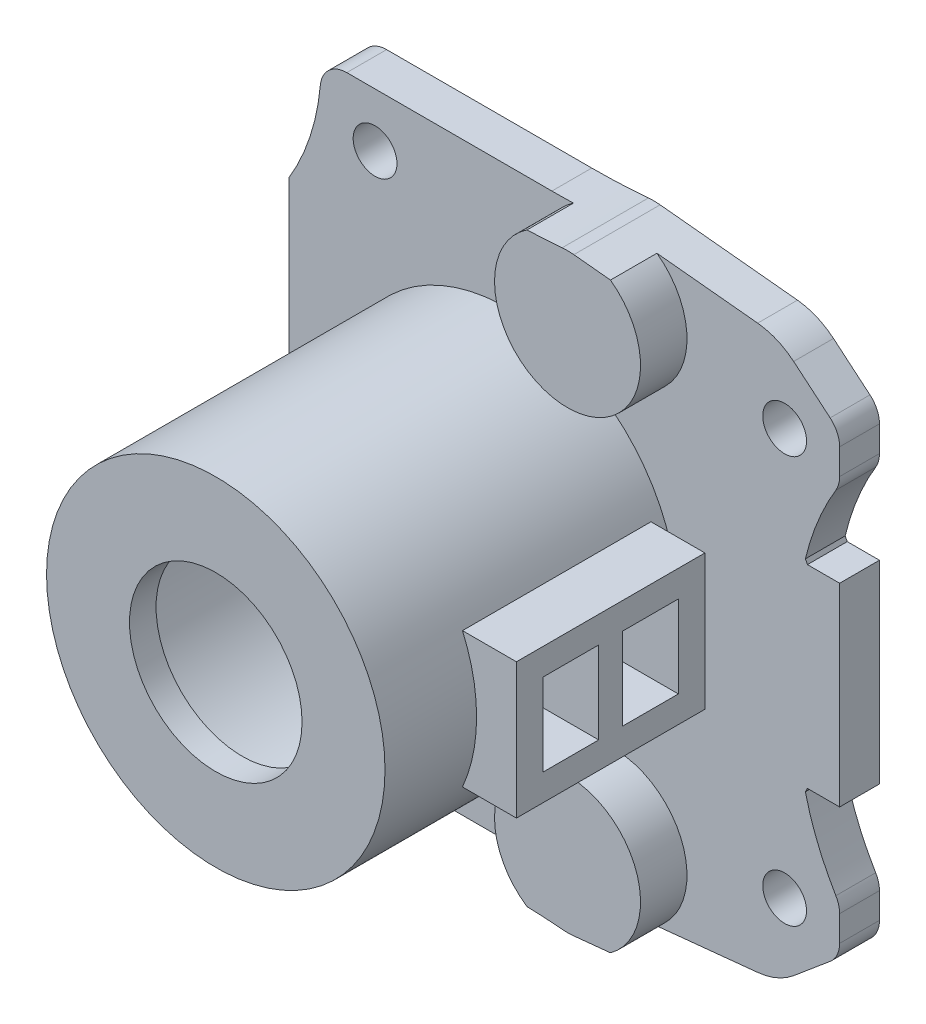
from build123d import *
from build123d.topology import SkipClean

# Parameters (mm, degrees)
SKETCH_1_R               = 2.05
EXTRUDE_1_DEPTH          = 3
EXTRUDE_START            = -3
SKETCH_2_R               = 2.05
SKETCH_2_R_2             = 1.65
SKETCH_2_R_3             = 6
EXTRUDE_2_DEPTH          = 3
SKETCH_3_R               = 4
EXTRUDE_3_DEPTH          = 2
EXTRUDE_4_DEPTH          = 1.5
SKETCH_5_R               = 12.75
SKETCH_5_R_2             = 10.75
EXTRUDE_5_DEPTH          = 20
CUT_EXTRUDE_START        = -3
SKETCH_6_R               = 10.75
CUT_EXTRUDE_1_DEPTH      = 3
SKETCH_8_R               = 12.75
SKETCH_8_R_2             = 6.5
EXTRUDE_6_DEPTH          = 2
CUT_EXTRUDE_2_REACH      = 43.774
CUT_EXTRUDE_2_END_RADIUS = 12.75
SKETCH_9_W               = 4.2
SKETCH_9_H               = 6.2
SKETCH_10_W              = 14.2
SKETCH_10_H              = 10.2
SKETCH_10_W_2            = 4.2
SKETCH_10_H_2            = 6.2
EXTRUDE_9_DEPTH          = 5


with BuildPart() as part:
    # Эскиз1 → Бобышка-Вытянуть1 (new body)
    with BuildSketch(Plane.XY):
        with BuildLine():
            Line((-12.130016239, -22.05), (6.63618183, -22.05))
            ThreePointArc((6.63618183, -22.05), (7.548005274, -22.228445915), (8.47712251, -22.225976525))
            Line((8.47712251, -22.225976525), (18.824472693, -21.181334498))
            ThreePointArc((18.824472693, -21.181334498), (20.266447405, -20.813145093), (21.53617652, -20.036844583))
            Line((21.53617652, -20.036844583), (24.285575219, -17.729825148))
            ThreePointArc((24.285575219, -17.729825148), (24.812615574, -17.042972786), (25, -16.197736262))
            Line((25, -16.197736262), (25, -14.258781673))
            ThreePointArc((25, -14.258781673), (24.927604034, -13.725543744), (24.715657311, -13.230910089))
            ThreePointArc((24.715657311, -13.230910089), (23.352457929, -10.503222461), (22.419778084, -7.6))
            Line((22.419778084, -7.6), (20.113215923, -7.6))
            ThreePointArc((20.113215923, -7.6), (16.619779633, -11.410056927), (12, -13.729166034))
            Line((12, -13.729166034), (12, -17.5))
            ThreePointArc((12, -17.5), (8, -21.5), (4, -17.5))
            Line((4, -17.5), (4, -13.729166034))
            ThreePointArc((4, -13.729166034), (-6.3, 0), (4, 13.729166034))
            Line((4, 13.729166034), (4, 17.5))
            ThreePointArc((4, 17.5), (8, 21.5), (12, 17.5))
            Line((12, 17.5), (12, 13.729166034))
            ThreePointArc((12, 13.729166034), (16.619779633, 11.410056927), (20.113215923, 7.6))
            Line((20.113215923, 7.6), (22.419778084, 7.6))
            ThreePointArc((22.419778084, 7.6), (23.352457929, 10.503222461), (24.715657311, 13.230910089))
            ThreePointArc((24.715657311, 13.230910089), (24.927604034, 13.725543744), (25, 14.258781673))
            Line((25, 14.258781673), (25, 16.197736262))
            ThreePointArc((25, 16.197736262), (24.812615574, 17.042972786), (24.285575219, 17.729825148))
            Line((24.285575219, 17.729825148), (21.53617652, 20.036844583))
            ThreePointArc((21.53617652, 20.036844583), (20.266447405, 20.813145093), (18.824472693, 21.181334498))
            Line((18.824472693, 21.181334498), (8.47712251, 22.225976525))
            ThreePointArc((8.47712251, 22.225976525), (8.035899486, 22.249864338), (7.594365799, 22.232648402))
            ThreePointArc((7.594365799, 22.232648402), (5.461401325, 22.09568297), (3.324532109, 22.05))
            Line((3.324532109, 22.05), (-12.130016239, 22.05))
            ThreePointArc((-12.130016239, 22.05), (-13.477844915, 21.527618984), (-14.121593477, 20.233357861))
            ThreePointArc((-14.121593477, 20.233357861), (-14.900607263, 16.481804182), (-16.5, 13))
            Line((-16.5, 13), (-16.5, -13))
            ThreePointArc((-16.5, -13), (-14.900607263, -16.481804182), (-14.121593477, -20.233357861))
            ThreePointArc((-14.121593477, -20.233357861), (-13.477844915, -21.527618984), (-12.130016239, -22.05))
        make_face()
        with Locations((-10, -18)):
            Circle(SKETCH_1_R, mode=Mode.SUBTRACT)
        with Locations((20.855752194, -15.320888862)):
            Circle(SKETCH_1_R, mode=Mode.SUBTRACT)
        with Locations((20.855752194, 15.320888862)):
            Circle(SKETCH_1_R, mode=Mode.SUBTRACT)
        with Locations((-10, 18)):
            Circle(SKETCH_1_R, mode=Mode.SUBTRACT)
    extrude(amount=EXTRUDE_1_DEPTH)

    # Эскиз2 → Бобышка-Вытянуть2 (add)
    # profile 1 of 5: a face of its own
    with SkipClean():  # the faces are left unmerged after this step: merging them gives an invalid solid
        with BuildSketch(Plane.XY.offset(3).offset(EXTRUDE_START)):
            with Locations((20.855752194, -15.320888862)):
                Circle(SKETCH_2_R)
            with Locations((20.855752194, -15.320888862)):
                Circle(SKETCH_2_R_2, mode=Mode.SUBTRACT)
        # profile 2 of 5: a face of its own
        with BuildSketch(Plane.XY.offset(3).offset(EXTRUDE_START)):
            with Locations((-10, -18)):
                Circle(SKETCH_2_R)
            with Locations((-10, -18)):
                Circle(SKETCH_2_R_2, mode=Mode.SUBTRACT)
        # profile 3 of 5: a face of its own
        with BuildSketch(Plane.XY.offset(3).offset(EXTRUDE_START)):
            with Locations((20.855752194, 15.320888862)):
                Circle(SKETCH_2_R)
            with Locations((20.855752194, 15.320888862)):
                Circle(SKETCH_2_R_2, mode=Mode.SUBTRACT)
        # profile 4 of 5: a face of its own
        with BuildSketch(Plane.XY.offset(3).offset(EXTRUDE_START)):
            with Locations((-10, 18)):
                Circle(SKETCH_2_R)
            with Locations((-10, 18)):
                Circle(SKETCH_2_R_2, mode=Mode.SUBTRACT)
        # profile 5 of 5: a face of its own
        with BuildSketch(Plane.XY.offset(3).offset(EXTRUDE_START)):
            with BuildLine():
                Line((20.113215923, 7.6), (22.419778084, 7.6))
                ThreePointArc((22.419778084, 7.6), (22.497639732, 7.450398794), (22.573949362, 7.3))
                Line((22.573949362, 7.3), (25, 7.3))
                Line((25, 7.3), (25, -7.3))
                Line((25, -7.3), (22.573949362, -7.3))
                ThreePointArc((22.573949362, -7.3), (22.497639732, -7.450398794), (22.419778084, -7.6))
                Line((22.419778084, -7.6), (20.113215923, -7.6))
                ThreePointArc((20.113215923, -7.6), (16.619779633, -11.410056927), (12, -13.729166034))
                Line((12, -13.729166034), (12, -17.5))
                ThreePointArc((12, -17.5), (8, -13.5), (4, -17.5))
                Line((4, -17.5), (4, -13.729166034))
                ThreePointArc((4, -13.729166034), (-6.3, 0), (4, 13.729166034))
                Line((4, 13.729166034), (4, 17.5))
                ThreePointArc((4, 17.5), (8, 13.5), (12, 17.5))
                Line((12, 17.5), (12, 13.729166034))
                ThreePointArc((12, 13.729166034), (16.619779633, 11.410056927), (20.113215923, 7.6))
            make_face()
            Circle(SKETCH_2_R_3, mode=Mode.SUBTRACT)
        extrude(amount=EXTRUDE_2_DEPTH)

    # Эскиз3 → Бобышка-Вытянуть3 (add)
    # profile 1 of 2: a face of its own
    with SkipClean():  # the faces are left unmerged after this step: merging them gives an invalid solid
        with BuildSketch(Plane.XY.offset(3)):
            with BuildLine():
                Line((11.235733835, 21.947474176), (8.47712251, 22.225976525))
                ThreePointArc((8.47712251, 22.225976525), (8.035899486, 22.249864338), (7.594365799, 22.232648402))
                ThreePointArc((7.594365799, 22.232648402), (6.272890386, 22.137003862), (4.949344701, 22.076407133))
                ThreePointArc((4.949344701, 22.076407133), (7.887219492, 12.001156435), (11.235733835, 21.947474176))
            make_face()
            with Locations((8, 17.5)):
                Circle(SKETCH_3_R, mode=Mode.SUBTRACT)
        # profile 2 of 2: a face of its own
        with BuildSketch(Plane.XY.offset(3)):
            with BuildLine():
                Line((11.235733835, -21.947474176), (8.47712251, -22.225976525))
                ThreePointArc((8.47712251, -22.225976525), (8.035899486, -22.249864338), (7.594365799, -22.232648402))
                ThreePointArc((7.594365799, -22.232648402), (6.272890386, -22.137003862), (4.949344701, -22.076407133))
                ThreePointArc((4.949344701, -22.076407133), (7.887219492, -12.001156435), (11.235733835, -21.947474176))
            make_face()
            with Locations(Location((8, -17.5, 0), (0, 0, 180))):
                Circle(SKETCH_3_R, mode=Mode.SUBTRACT)
        extrude(amount=EXTRUDE_3_DEPTH)

    # Эскиз4 → Бобышка-Вытянуть4 (add)
    with SkipClean():  # the faces are left unmerged after this step: merging them gives an invalid solid
        with BuildSketch(Plane.XY.offset(5)):
            with BuildLine():
                Line((8.47712251, -22.225976525), (11.235733835, -21.947474176))
                ThreePointArc((11.235733835, -21.947474176), (7.887219492, -12.001156435), (4.949344701, -22.076407133))
                ThreePointArc((4.949344701, -22.076407133), (6.272890386, -22.137003862), (7.594365799, -22.232648402))
                ThreePointArc((7.594365799, -22.232648402), (8.035899486, -22.249864338), (8.47712251, -22.225976525))
            make_face()
            with BuildLine():
                Line((11.235733835, 21.947474176), (8.47712251, 22.225976525))
                ThreePointArc((8.47712251, 22.225976525), (8.035899486, 22.249864338), (7.594365799, 22.232648402))
                ThreePointArc((7.594365799, 22.232648402), (6.272890386, 22.137003862), (4.949344701, 22.076407133))
                ThreePointArc((4.949344701, 22.076407133), (7.887219492, 12.001156435), (11.235733835, 21.947474176))
            make_face()
        extrude(amount=EXTRUDE_4_DEPTH)

    # Эскиз5 → Бобышка-Вытянуть5 (add)
    with SkipClean():  # the faces are left unmerged after this step: merging them gives an invalid solid
        with BuildSketch(Plane.XY.offset(3)):
            Circle(SKETCH_5_R)
            Circle(SKETCH_5_R_2, mode=Mode.SUBTRACT)
        extrude(amount=EXTRUDE_5_DEPTH)

    # Эскиз6 → Вырез-Вытянуть1 (cut)
    with SkipClean():  # the faces are left unmerged after this step: merging them gives an invalid solid
        with BuildSketch(Plane.XY.offset(3).offset(CUT_EXTRUDE_START)):
            Circle(SKETCH_6_R)
        extrude(amount=CUT_EXTRUDE_1_DEPTH, mode=Mode.SUBTRACT)

    # Эскиз8 → Бобышка-Вытянуть6 (add)
    with SkipClean():  # the faces are left unmerged after this step: merging them gives an invalid solid
        with BuildSketch(Plane.XY.offset(23)):
            Circle(SKETCH_8_R)
            Circle(SKETCH_8_R_2, mode=Mode.SUBTRACT)
        extrude(amount=EXTRUDE_6_DEPTH)

    # Вырез-Вытянуть2: up to this cylinder (the profile starts inside it)
    with SkipClean():  # the faces are left unmerged after this step: merging them gives an invalid solid
        cut_extrude_2_end = Plane(origin=(0, 0, 11), z_dir=(0, 0, -1)) * Cylinder(CUT_EXTRUDE_2_END_RADIUS, 120.048, mode=Mode.PRIVATE)
        # Эскиз9 → Вырез-Вытянуть2 (cut, up to the surface)
        with BuildSketch(Plane(origin=(0, 0, 0), x_dir=(0, 0, -1), z_dir=(1, 0, 0)), mode=Mode.PRIVATE) as cut_extrude_2_sk1:
            with Locations((-8, 0)):
                Rectangle(SKETCH_9_W, SKETCH_9_H)
        cut_extrude_2_tool1 = extrude(cut_extrude_2_sk1.sketch, amount=CUT_EXTRUDE_2_REACH, mode=Mode.PRIVATE) & cut_extrude_2_end
        add(cut_extrude_2_tool1.solids().sort_by_distance((0, 0, 8))[0], mode=Mode.SUBTRACT)
        # Эскиз9 → Вырез-Вытянуть2 (cut, up to the surface)
        with BuildSketch(Plane(origin=(0, 0, 0), x_dir=(0, 0, -1), z_dir=(1, 0, 0)), mode=Mode.PRIVATE) as cut_extrude_2_sk2:
            with Locations((-14, 0)):
                Rectangle(SKETCH_9_W, SKETCH_9_H)
        cut_extrude_2_tool2 = extrude(cut_extrude_2_sk2.sketch, amount=CUT_EXTRUDE_2_REACH, mode=Mode.PRIVATE) & cut_extrude_2_end
        add(cut_extrude_2_tool2.solids().sort_by_distance((0, 0, 14))[0], mode=Mode.SUBTRACT)

    # Эскиз10 → Бобышка-Вытянуть9 (add)
    with SkipClean():  # the faces are left unmerged after this step: merging them gives an invalid solid
        with BuildSketch(Plane.ZY.offset(-10.75)):
            with Locations((11, 0)):
                Rectangle(SKETCH_10_W, SKETCH_10_H)
            with Locations((14, 0)):
                Rectangle(SKETCH_10_W_2, SKETCH_10_H_2, mode=Mode.SUBTRACT)
            with Locations((8, 0)):
                Rectangle(SKETCH_10_W_2, SKETCH_10_H_2, mode=Mode.SUBTRACT)
        extrude(amount=-EXTRUDE_9_DEPTH)


solid = part.part
